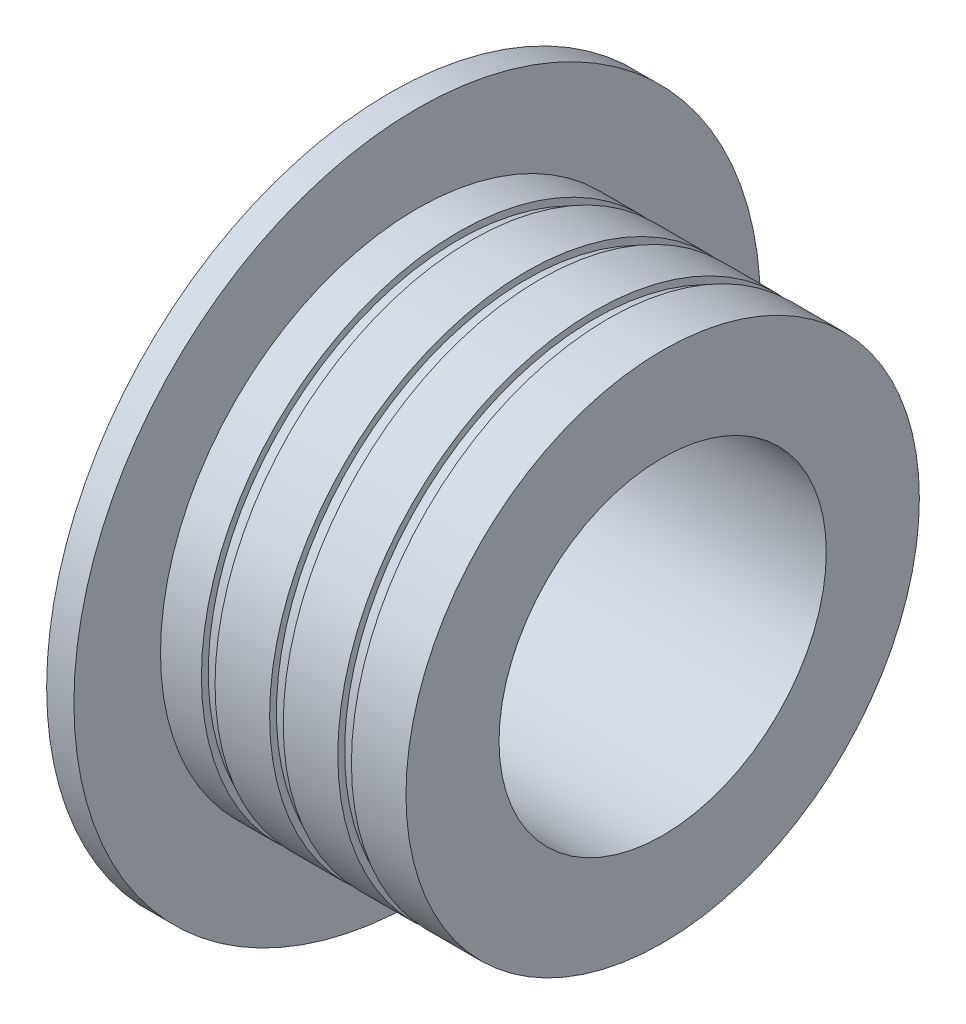
from build123d import *

# Parameters (mm, degrees)
SKETCH2_W = 1
SKETCH2_H = 0.5


with BuildPart() as part:
    # Sketch1 → Revolve1 (revolve)
    with BuildSketch(Plane.XY, mode=Mode.PRIVATE) as revolve1_sk:
        Polygon((10.740740741, -3.925925926), (-9.259259259, -3.925925926), (-9.259259259, 9.249074074), (-7.259259259, 9.249074074), (-7.259259259, 2.899074074), (10.740740741, 2.899074074), align=None)
    revolve(revolve1_sk.sketch.rotate(Axis((-9.259259259, -15.925925926, 0), (1, 0, 0)), 90), axis=Axis((-9.259259259, -15.925925926, 0), (1, 0, 0)))

    # Sketch2 → Cut-Revolve1 (revolve, cut)
    with BuildSketch(Plane.XY, mode=Mode.PRIVATE) as cut_revolve1_sk:
        with Locations((6.240740741, 2.649074074)):
            Rectangle(SKETCH2_W, SKETCH2_H)
        with Locations((1.240740741, 2.649074074)):
            Rectangle(SKETCH2_W, SKETCH2_H)
        with Locations((-3.759259259, 2.649074074)):
            Rectangle(SKETCH2_W, SKETCH2_H)
    revolve(cut_revolve1_sk.sketch.rotate(Axis((10.740740741, -15.925925926, 0), (-1, 0, 0)), 90), axis=Axis((10.740740741, -15.925925926, 0), (-1, 0, 0)), mode=Mode.SUBTRACT)


solid = part.part
